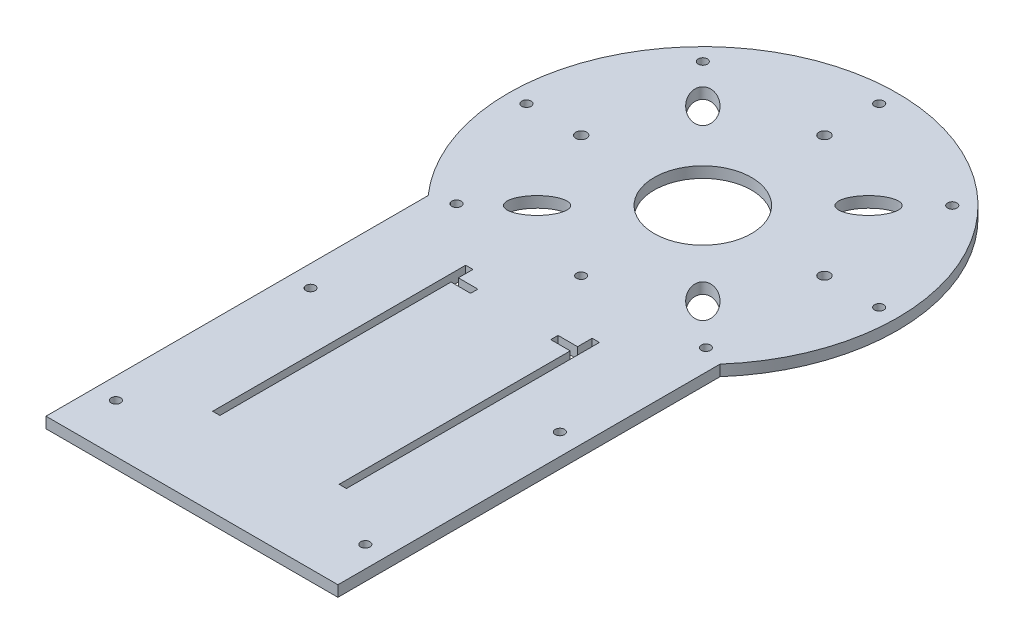
from build123d import *

# Parameters (mm, degrees)
SKETCH1_R           = 1.905
SKETCH1_R_2         = 2.25
SKETCH1_R_3         = 20
BOSS_EXTRUDE1_DEPTH = 4.5


with BuildPart() as part:
    # Sketch1 → Boss-Extrude1 (new body)
    with BuildSketch(Plane(origin=(0, 0, 0), x_dir=(1, 0, 0), z_dir=(0, 1, 0))):
        with BuildLine():
            ThreePointArc((8.75, 137.084973779), (-51.25, 270), (-111.25, 137.084973779))
            Line((-111.25, 137.084973779), (-111.25, -20))
            Line((-111.25, -20), (8.75, -20))
            Line((8.75, -20), (8.75, 137.084973779))
        make_face()
        Polygon((-23.75, 120), (-23.75, 16), (-26.75, 16), (-26.75, 111), (-34.779961709, 111), (-34.779961709, 114), (-26.75, 114), (-26.75, 120), align=None, mode=Mode.SUBTRACT)
        Polygon((-67.720038291, 114), (-67.720038291, 111), (-75.75, 111), (-75.75, 16), (-78.75, 16), (-78.75, 120), (-75.75, 120), (-75.75, 114), align=None, mode=Mode.SUBTRACT)
        with BuildLine():
            ThreePointArc((-104.405, 140), (-102.5, 141.905), (-100.595, 140))
            ThreePointArc((-100.595, 140), (-102.5, 138.095), (-104.405, 140))
        make_face(mode=Mode.SUBTRACT)
        with Locations(Location((-51.25, 140, 0), (0, 0, 270))):
            Circle(SKETCH1_R, mode=Mode.SUBTRACT)
        with BuildLine():
            add(Edge.make_bspline(
                [(-92.232996185, 149.017003815), (-86.109271828, 142.893279458), (-78.798938187, 156.327337456), (-71.488604545, 169.761395455), (-84.922662544, 162.451061813), (-98.356720542, 155.140728172), (-92.232996185, 149.017003815)],
                knots=[0, 0, 0, 2.094395102, 2.094395102, 4.188790205, 4.188790205, 6.283185307, 6.283185307, 6.283185307], degree=2, weights=[1, 0.5, 1, 0.5, 1, 0.5, 1]))
        make_face(mode=Mode.SUBTRACT)
        with Locations(Location((-123.75, 190, 0), (0, 0, 270))):
            Circle(SKETCH1_R, mode=Mode.SUBTRACT)
        with Locations(Location((-101.25, 190, 0), (0, 0, 270))):
            Circle(SKETCH1_R_2, mode=Mode.SUBTRACT)
        with Locations(Location((-51.25, 190, 0), (0, 0, 270))):
            Circle(SKETCH1_R_3, mode=Mode.SUBTRACT)
        with BuildLine():
            add(Edge.make_bspline(
                [(-10.267003815, 149.017003815), (-4.143279458, 155.140728172), (-17.577337456, 162.451061813), (-31.011395455, 169.761395455), (-23.701061813, 156.327337456), (-16.390728172, 142.893279458), (-10.267003815, 149.017003815)],
                knots=[0, 0, 0, 2.094395102, 2.094395102, 4.188790205, 4.188790205, 6.283185307, 6.283185307, 6.283185307], degree=2, weights=[1, 0.5, 1, 0.5, 1, 0.5, 1]))
        make_face(mode=Mode.SUBTRACT)
        with Locations(Location((0, 140, 0), (0, 0, 270))):
            Circle(SKETCH1_R, mode=Mode.SUBTRACT)
        with Locations(Location((-1.25, 190, 0), (0, 0, 270))):
            Circle(SKETCH1_R_2, mode=Mode.SUBTRACT)
        with Locations(Location((21.25, 190, 0), (0, 0, 270))):
            Circle(SKETCH1_R, mode=Mode.SUBTRACT)
        with BuildLine():
            add(Edge.make_bspline(
                [(-93.520136273, 232.270136273), (-99.64386063, 226.146411916), (-86.209802631, 218.836078274), (-72.775744633, 211.525744633), (-80.086078274, 224.959802631), (-87.396411916, 238.39386063), (-93.520136273, 232.270136273)],
                knots=[0, 0, 0, 2.094395102, 2.094395102, 4.188790205, 4.188790205, 6.283185307, 6.283185307, 6.283185307], degree=2, weights=[1, 0.5, 1, 0.5, 1, 0.5, 1]))
        make_face(mode=Mode.SUBTRACT)
        with Locations(Location((-102.515241636, 241.265241636, 0), (0, 0, 270))):
            Circle(SKETCH1_R, mode=Mode.SUBTRACT)
        with Locations(Location((-51.25, 240, 0), (0, 0, 270))):
            Circle(SKETCH1_R_2, mode=Mode.SUBTRACT)
        with BuildLine():
            add(Edge.make_bspline(
                [(-10.267003815, 230.982996185), (-16.390728172, 237.106720542), (-23.701061813, 223.672662544), (-31.011395455, 210.238604545), (-17.577337456, 217.548938187), (-4.143279458, 224.859271828), (-10.267003815, 230.982996185)],
                knots=[0, 0, 0, 2.094395102, 2.094395102, 4.188790205, 4.188790205, 6.283185307, 6.283185307, 6.283185307], degree=2, weights=[1, 0.5, 1, 0.5, 1, 0.5, 1]))
        make_face(mode=Mode.SUBTRACT)
        with Locations(Location((-51.25, 262.5, 0), (0, 0, 270))):
            Circle(SKETCH1_R, mode=Mode.SUBTRACT)
        with Locations(Location((0.015241636, 241.265241636, 0), (0, 0, 270))):
            Circle(SKETCH1_R, mode=Mode.SUBTRACT)
        with Locations(Location((0, 80, 0), (0, 0, 270))):
            Circle(SKETCH1_R, mode=Mode.SUBTRACT)
        with Locations(Location((-102.5, 80, 0), (0, 0, 270))):
            Circle(SKETCH1_R, mode=Mode.SUBTRACT)
        with Locations(Location((0, 0, 0), (0, 0, 270))):
            Circle(SKETCH1_R, mode=Mode.SUBTRACT)
        with Locations(Location((-102.5, 0, 0), (0, 0, 270))):
            Circle(SKETCH1_R, mode=Mode.SUBTRACT)
    extrude(amount=BOSS_EXTRUDE1_DEPTH)


solid = part.part
